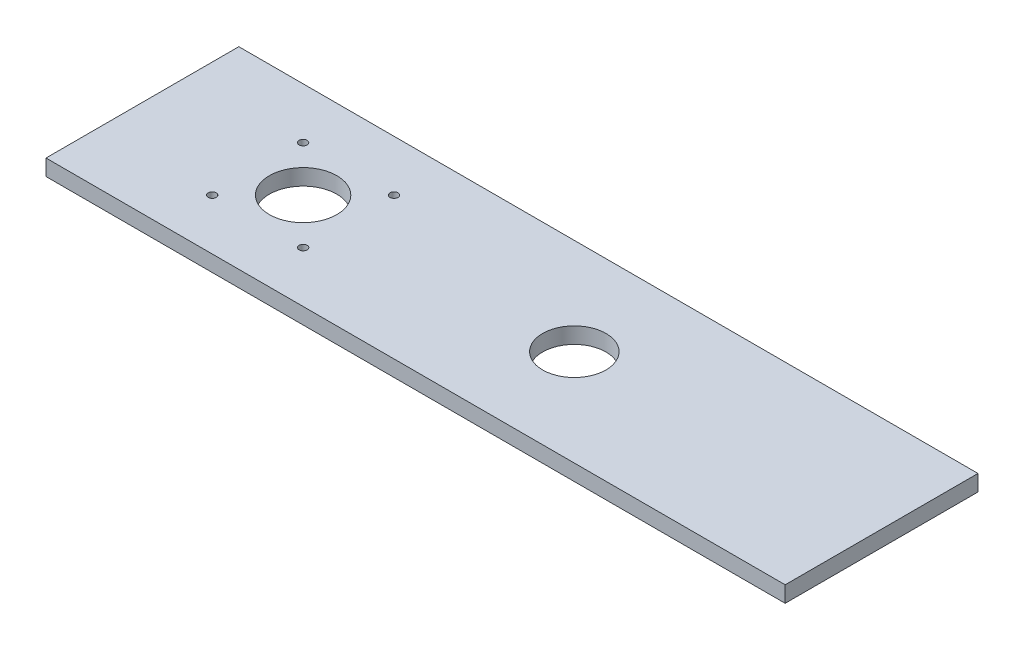
from build123d import *

# Parameters (mm, degrees)
SKETCH1_W             = 230
SKETCH1_H             = 60
SKETCH1_R             = 10.5
SKETCH1_R_2           = 9.848320848
BOSS_EXTRUDE1_DEPTH   = 5
M3X0_5_TAPPED_HOLE1_D = 2.5


with BuildPart() as part:
    # Sketch1 → Boss-Extrude1 (new body)
    with BuildSketch(Plane(origin=(0, 0, 0), x_dir=(1, 0, 0), z_dir=(0, 1, 0))):
        with Locations((65, 0)):
            Rectangle(SKETCH1_W, SKETCH1_H)
        with Locations(Location((0, 0, 0), (0, 0, 270))):
            Circle(SKETCH1_R, mode=Mode.SUBTRACT)
        with Locations(Location((84.38561279, 0, 0), (0, 0, 270))):
            Circle(SKETCH1_R_2, mode=Mode.SUBTRACT)
    extrude(amount=BOSS_EXTRUDE1_DEPTH)

    # M3x0.5 Tapped Hole1 (through all)
    with Locations(Plane(origin=(0, 5, 0), x_dir=(1, 0, 0), z_dir=(0, 1, 0))):
        with Locations((-14.142135624, 14.142135624), (14.142135624, 14.142135624), (14.142135624, -14.142135624), (-14.142135624, -14.142135624), (0, 0)):
            Hole(M3X0_5_TAPPED_HOLE1_D / 2)


solid = part.part
